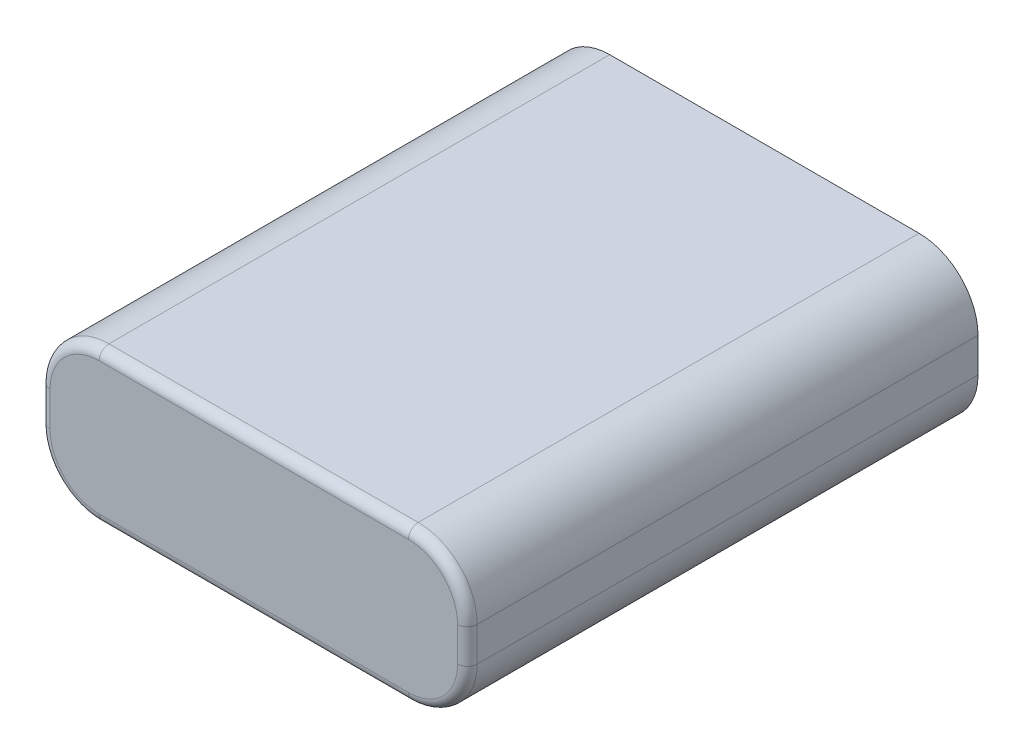
from build123d import *

# Parameters (mm, degrees)
BOSS_EXTRUDE1_DEPTH = 52
FILLET1_R           = 1


with BuildPart() as part:
    # Sketch2 → Boss-Extrude1 (new body)
    with BuildSketch(Plane.XY):
        with BuildLine():
            Line((-15.75, -7.75), (15.75, -7.75))
            ThreePointArc((15.75, -7.75), (19.992640687, -5.992640687), (21.75, -1.75))
            Line((21.75, -1.75), (21.75, 1.75))
            ThreePointArc((21.75, 1.75), (19.992640687, 5.992640687), (15.75, 7.75))
            Line((15.75, 7.75), (-15.75, 7.75))
            ThreePointArc((-15.75, 7.75), (-19.992640687, 5.992640687), (-21.75, 1.75))
            Line((-21.75, 1.75), (-21.75, -1.75))
            ThreePointArc((-21.75, -1.75), (-19.992640687, -5.992640687), (-15.75, -7.75))
        make_face()
    extrude(amount=BOSS_EXTRUDE1_DEPTH)

    # Fillet1
    fillet1_edges = [part.edges().sort_by_distance(p)[0] for p in [
        (-19.992640687, 5.992640687, 52),
        (-21.75, 0, 52),
        (-19.992640687, -5.992640687, 52),
        (0, -7.75, 52),
        (19.992640687, -5.992640687, 52),
        (21.75, 0, 52),
        (19.992640687, 5.992640687, 52),
        (0, 7.75, 52),
    ]]
    fillet(fillet1_edges, radius=FILLET1_R)


solid = part.part
